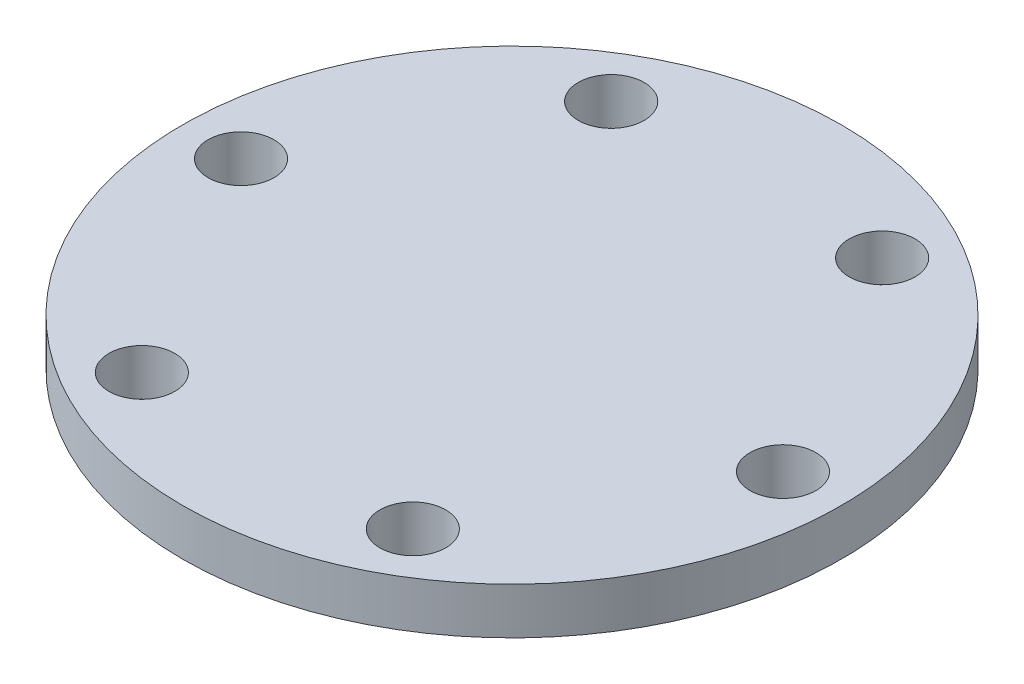
from build123d import *

# Parameters (mm, degrees)
SKETCH2_R           = 22.5
SKETCH2_R_2         = 2.25
BOSS_EXTRUDE1_DEPTH = 3.175


with BuildPart() as part:
    # Sketch2 → Boss-Extrude1 (new body)
    with BuildSketch(Plane(origin=(0, 236.49, 0), x_dir=(1, 0, 0), z_dir=(0, 1, 0))):
        with Locations(Location((0, 0, 0), (0, 0, 270))):
            Circle(SKETCH2_R)
        with Locations(Location((9.25, 16.02146997, 0), (0, 0, 270))):
            Circle(SKETCH2_R_2, mode=Mode.SUBTRACT)
        with Locations(Location((18.5, 0, 0), (0, 0, 270))):
            Circle(SKETCH2_R_2, mode=Mode.SUBTRACT)
        with Locations(Location((9.25, -16.02146997, 0), (0, 0, 270))):
            Circle(SKETCH2_R_2, mode=Mode.SUBTRACT)
        with Locations(Location((-9.25, -16.02146997, 0), (0, 0, 270))):
            Circle(SKETCH2_R_2, mode=Mode.SUBTRACT)
        with Locations(Location((-18.5, 0, 0), (0, 0, 270))):
            Circle(SKETCH2_R_2, mode=Mode.SUBTRACT)
        with Locations(Location((-9.25, 16.02146997, 0), (0, 0, 270))):
            Circle(SKETCH2_R_2, mode=Mode.SUBTRACT)
    extrude(amount=-BOSS_EXTRUDE1_DEPTH)


solid = part.part
